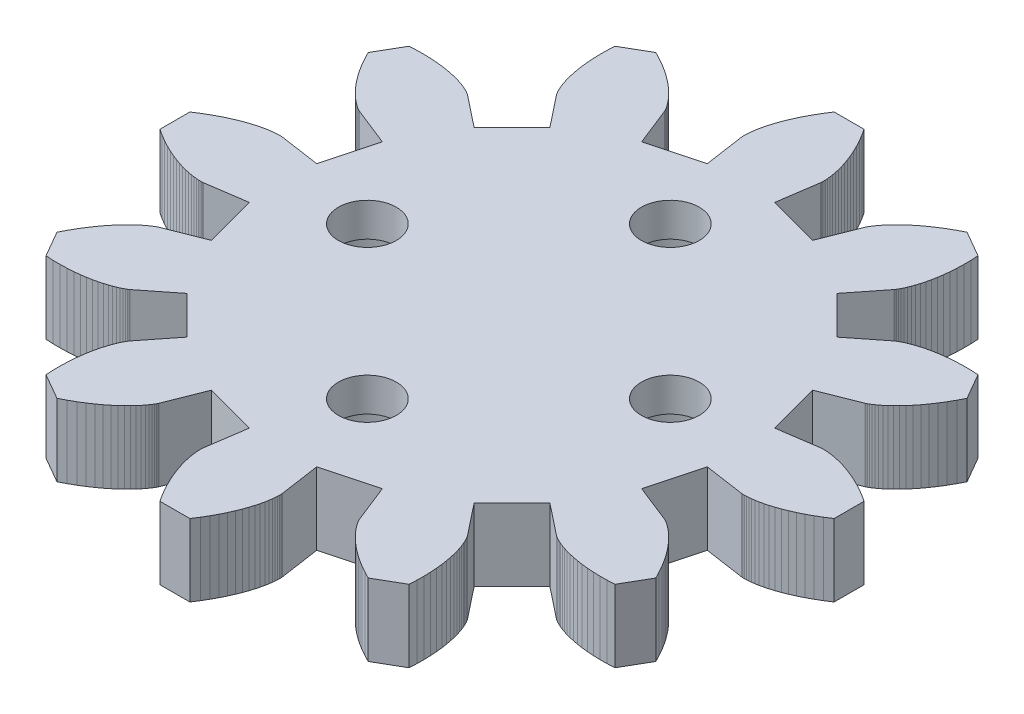
from build123d import *

# Parameters (mm, degrees)
BOSS_EXTRUDE1_DEPTH = 3
CIRPATTERN1_COUNT   = 4


with BuildPart() as part:
    # Sketch2 → Boss-Extrude1 (new body)
    with BuildSketch(Plane(origin=(0, 0, 0), x_dir=(1, 0, 0), z_dir=(0, 1, 0))):
        Polygon((9.498138322, 1.394764644), (11.156663116, 1.638312555), (11.165058045, 1.639324689), (11.190331947, 1.64149246), (11.232561637, 1.64350814), (11.291747908, 1.644060767), (11.367815439, 1.64184007), (11.460612882, 1.635540401), (11.569913152, 1.623864649), (11.695413894, 1.605528155), (11.836738145, 1.579262579), (11.993435184, 1.543819756), (12.164981564, 1.497975492), (12.350782331, 1.440533319), (12.550172424, 1.370328182), (12.762418247, 1.286230068), (12.986719425, 1.18714755), (13.222210727, 1.072031248), (13.467964155, 0.939877204), (13.722991197, 0.789730147), (13.986245242, 0.620686658), (13.986245242, -0.620686658), (13.722991197, -0.789730147), (13.467964155, -0.939877204), (13.222210727, -1.072031248), (12.986719425, -1.18714755), (12.762418247, -1.286230068), (12.550172424, -1.370328182), (12.350782331, -1.440533319), (12.164981564, -1.497975492), (11.993435184, -1.543819756), (11.836738145, -1.579262579), (11.695413894, -1.605528155), (11.569913152, -1.623864649), (11.460612882, -1.635540401), (11.367815439, -1.64184007), (11.291747908, -1.644060767), (11.232561637, -1.64350814), (11.190331947, -1.64149246), (11.165058045, -1.639324689), (11.156663116, -1.638312555), (9.498138322, -1.394764644), (8.923011398, -3.541167547), (10.481109957, -4.159511266), (10.488886246, -4.162832196), (10.511857973, -4.173591803), (10.549437797, -4.192961018), (10.600970925, -4.222075565), (10.665736991, -4.262032509), (10.742952099, -4.313886905), (10.831771034, -4.378648537), (10.931289617, -4.457278779), (11.040547221, -4.55068756), (11.158529426, -4.659730464), (11.284170817, -4.785205951), (11.416357915, -4.927852717), (11.553932232, -5.088347195), (11.695693449, -5.267301209), (11.840402709, -5.465259777), (11.986786008, -5.682699069), (12.133537698, -5.920024542), (12.279324066, -6.177569229), (12.422787013, -6.455592207), (11.802100354, -7.530653035), (11.489593919, -7.545421968), (11.193660493, -7.547939613), (10.91475476, -7.539511658), (10.653255159, -7.521459649), (10.409463382, -7.495117037), (10.18360405, -7.461825229), (9.975824596, -7.422929615), (9.786195324, -7.379775612), (9.61470967, -7.333704719), (9.461284642, -7.286050585), (9.325761463, -7.238135115), (9.207906385, -7.191264615), (9.107411699, -7.146725977), (9.02389692, -7.105782929), (8.956910158, -7.069672344), (8.905929657, -7.039600619), (8.870365513, -7.016740144), (8.849561557, -7.002225848), (8.842797402, -6.99715185), (7.528246754, -5.956970775), (5.956970775, -7.528246754), (6.99715185, -8.842797402), (7.002225848, -8.849561557), (7.016740144, -8.870365513), (7.039600619, -8.905929657), (7.069672344, -8.956910158), (7.105782929, -9.02389692), (7.146725977, -9.107411699), (7.191264615, -9.207906385), (7.238135115, -9.325761463), (7.286050585, -9.461284642), (7.333704719, -9.61470967), (7.379775612, -9.786195324), (7.422929615, -9.975824596), (7.461825229, -10.18360405), (7.495117037, -10.409463382), (7.521459649, -10.653255159), (7.539511658, -10.91475476), (7.547939613, -11.193660493), (7.545421968, -11.489593919), (7.530653035, -11.802100354), (6.455592207, -12.422787013), (6.177569229, -12.279324066), (5.920024542, -12.133537698), (5.682699069, -11.986786008), (5.465259777, -11.840402709), (5.267301209, -11.695693449), (5.088347195, -11.553932232), (4.927852717, -11.416357915), (4.785205951, -11.284170817), (4.659730464, -11.158529426), (4.55068756, -11.040547221), (4.457278779, -10.931289617), (4.378648537, -10.831771034), (4.313886905, -10.742952099), (4.262032509, -10.665736991), (4.222075565, -10.600970925), (4.192961018, -10.549437797), (4.173591803, -10.511857973), (4.162832196, -10.488886246), (4.159511266, -10.481109957), (3.541167547, -8.923011398), (1.394764644, -9.498138322), (1.638312555, -11.156663116), (1.639324689, -11.165058045), (1.64149246, -11.190331947), (1.64350814, -11.232561637), (1.644060767, -11.291747908), (1.64184007, -11.367815439), (1.635540401, -11.460612882), (1.623864649, -11.569913152), (1.605528155, -11.695413894), (1.579262579, -11.836738145), (1.543819756, -11.993435184), (1.497975492, -12.164981564), (1.440533319, -12.350782331), (1.370328182, -12.550172424), (1.286230068, -12.762418247), (1.18714755, -12.986719425), (1.072031248, -13.222210727), (0.939877204, -13.467964155), (0.789730147, -13.722991197), (0.620686658, -13.986245242), (-0.620686658, -13.986245242), (-0.789730147, -13.722991197), (-0.939877204, -13.467964155), (-1.072031248, -13.222210727), (-1.18714755, -12.986719425), (-1.286230068, -12.762418247), (-1.370328182, -12.550172424), (-1.440533319, -12.350782331), (-1.497975492, -12.164981564), (-1.543819756, -11.993435184), (-1.579262579, -11.836738145), (-1.605528155, -11.695413894), (-1.623864649, -11.569913152), (-1.635540401, -11.460612882), (-1.64184007, -11.367815439), (-1.644060767, -11.291747908), (-1.64350814, -11.232561637), (-1.64149246, -11.190331947), (-1.639324689, -11.165058045), (-1.638312555, -11.156663116), (-1.394764644, -9.498138322), (-3.541167547, -8.923011398), (-4.159511266, -10.481109957), (-4.162832196, -10.488886246), (-4.173591803, -10.511857973), (-4.192961018, -10.549437797), (-4.222075565, -10.600970925), (-4.262032509, -10.665736991), (-4.313886905, -10.742952099), (-4.378648537, -10.831771034), (-4.457278779, -10.931289617), (-4.55068756, -11.040547221), (-4.659730464, -11.158529426), (-4.785205951, -11.284170817), (-4.927852717, -11.416357915), (-5.088347195, -11.553932232), (-5.267301209, -11.695693449), (-5.465259777, -11.840402709), (-5.682699069, -11.986786008), (-5.920024542, -12.133537698), (-6.177569229, -12.279324066), (-6.455592207, -12.422787013), (-7.530653035, -11.802100354), (-7.545421968, -11.489593919), (-7.547939613, -11.193660493), (-7.539511658, -10.91475476), (-7.521459649, -10.653255159), (-7.495117037, -10.409463382), (-7.461825229, -10.18360405), (-7.422929615, -9.975824596), (-7.379775612, -9.786195324), (-7.333704719, -9.61470967), (-7.286050585, -9.461284642), (-7.238135115, -9.325761463), (-7.191264615, -9.207906385), (-7.146725977, -9.107411699), (-7.105782929, -9.02389692), (-7.069672344, -8.956910158), (-7.039600619, -8.905929657), (-7.016740144, -8.870365513), (-7.002225848, -8.849561557), (-6.99715185, -8.842797402), (-5.956970775, -7.528246754), (-7.528246754, -5.956970775), (-8.842797402, -6.99715185), (-8.849561557, -7.002225848), (-8.870365513, -7.016740144), (-8.905929657, -7.039600619), (-8.956910158, -7.069672344), (-9.02389692, -7.105782929), (-9.107411699, -7.146725977), (-9.207906385, -7.191264615), (-9.325761463, -7.238135115), (-9.461284642, -7.286050585), (-9.61470967, -7.333704719), (-9.786195324, -7.379775612), (-9.975824596, -7.422929615), (-10.18360405, -7.461825229), (-10.409463382, -7.495117037), (-10.653255159, -7.521459649), (-10.91475476, -7.539511658), (-11.193660493, -7.547939613), (-11.489593919, -7.545421968), (-11.802100354, -7.530653035), (-12.422787013, -6.455592207), (-12.279324066, -6.177569229), (-12.133537698, -5.920024542), (-11.986786008, -5.682699069), (-11.840402709, -5.465259777), (-11.695693449, -5.267301209), (-11.553932232, -5.088347195), (-11.416357915, -4.927852717), (-11.284170817, -4.785205951), (-11.158529426, -4.659730464), (-11.040547221, -4.55068756), (-10.931289617, -4.457278779), (-10.831771034, -4.378648537), (-10.742952099, -4.313886905), (-10.665736991, -4.262032509), (-10.600970925, -4.222075565), (-10.549437797, -4.192961018), (-10.511857973, -4.173591803), (-10.488886246, -4.162832196), (-10.481109957, -4.159511266), (-8.923011398, -3.541167547), (-9.498138322, -1.394764644), (-11.156663116, -1.638312555), (-11.165058045, -1.639324689), (-11.190331947, -1.64149246), (-11.232561637, -1.64350814), (-11.291747908, -1.644060767), (-11.367815439, -1.64184007), (-11.460612882, -1.635540401), (-11.569913152, -1.623864649), (-11.695413894, -1.605528155), (-11.836738145, -1.579262579), (-11.993435184, -1.543819756), (-12.164981564, -1.497975492), (-12.350782331, -1.440533319), (-12.550172424, -1.370328182), (-12.762418247, -1.286230068), (-12.986719425, -1.18714755), (-13.222210727, -1.072031248), (-13.467964155, -0.939877204), (-13.722991197, -0.789730147), (-13.986245242, -0.620686658), (-13.986245242, 0.620686658), (-13.722991197, 0.789730147), (-13.467964155, 0.939877204), (-13.222210727, 1.072031248), (-12.986719425, 1.18714755), (-12.762418247, 1.286230068), (-12.550172424, 1.370328182), (-12.350782331, 1.440533319), (-12.164981564, 1.497975492), (-11.993435184, 1.543819756), (-11.836738145, 1.579262579), (-11.695413894, 1.605528155), (-11.569913152, 1.623864649), (-11.460612882, 1.635540401), (-11.367815439, 1.64184007), (-11.291747908, 1.644060767), (-11.232561637, 1.64350814), (-11.190331947, 1.64149246), (-11.165058045, 1.639324689), (-11.156663116, 1.638312555), (-9.498138322, 1.394764644), (-8.923011398, 3.541167547), (-10.481109957, 4.159511266), (-10.488886246, 4.162832196), (-10.511857973, 4.173591803), (-10.549437797, 4.192961018), (-10.600970925, 4.222075565), (-10.665736991, 4.262032509), (-10.742952099, 4.313886905), (-10.831771034, 4.378648537), (-10.931289617, 4.457278779), (-11.040547221, 4.55068756), (-11.158529426, 4.659730464), (-11.284170817, 4.785205951), (-11.416357915, 4.927852717), (-11.553932232, 5.088347195), (-11.695693449, 5.267301209), (-11.840402709, 5.465259777), (-11.986786008, 5.682699069), (-12.133537698, 5.920024542), (-12.279324066, 6.177569229), (-12.422787013, 6.455592207), (-11.802100354, 7.530653035), (-11.489593919, 7.545421968), (-11.193660493, 7.547939613), (-10.91475476, 7.539511658), (-10.653255159, 7.521459649), (-10.409463382, 7.495117037), (-10.18360405, 7.461825229), (-9.975824596, 7.422929615), (-9.786195324, 7.379775612), (-9.61470967, 7.333704719), (-9.461284642, 7.286050585), (-9.325761463, 7.238135115), (-9.207906385, 7.191264615), (-9.107411699, 7.146725977), (-9.02389692, 7.105782929), (-8.956910158, 7.069672344), (-8.905929657, 7.039600619), (-8.870365513, 7.016740144), (-8.849561557, 7.002225848), (-8.842797402, 6.99715185), (-7.528246754, 5.956970775), (-5.956970775, 7.528246754), (-6.99715185, 8.842797402), (-7.002225848, 8.849561557), (-7.016740144, 8.870365513), (-7.039600619, 8.905929657), (-7.069672344, 8.956910158), (-7.105782929, 9.02389692), (-7.146725977, 9.107411699), (-7.191264615, 9.207906385), (-7.238135115, 9.325761463), (-7.286050585, 9.461284642), (-7.333704719, 9.61470967), (-7.379775612, 9.786195324), (-7.422929615, 9.975824596), (-7.461825229, 10.18360405), (-7.495117037, 10.409463382), (-7.521459649, 10.653255159), (-7.539511658, 10.91475476), (-7.547939613, 11.193660493), (-7.545421968, 11.489593919), (-7.530653035, 11.802100354), (-6.455592207, 12.422787013), (-6.177569229, 12.279324066), (-5.920024542, 12.133537698), (-5.682699069, 11.986786008), (-5.465259777, 11.840402709), (-5.267301209, 11.695693449), (-5.088347195, 11.553932232), (-4.927852717, 11.416357915), (-4.785205951, 11.284170817), (-4.659730464, 11.158529426), (-4.55068756, 11.040547221), (-4.457278779, 10.931289617), (-4.378648537, 10.831771034), (-4.313886905, 10.742952099), (-4.262032509, 10.665736991), (-4.222075565, 10.600970925), (-4.192961018, 10.549437797), (-4.173591803, 10.511857973), (-4.162832196, 10.488886246), (-4.159511266, 10.481109957), (-3.541167547, 8.923011398), (-1.394764644, 9.498138322), (-1.638312555, 11.156663116), (-1.639324689, 11.165058045), (-1.64149246, 11.190331947), (-1.64350814, 11.232561637), (-1.644060767, 11.291747908), (-1.64184007, 11.367815439), (-1.635540401, 11.460612882), (-1.623864649, 11.569913152), (-1.605528155, 11.695413894), (-1.579262579, 11.836738145), (-1.543819756, 11.993435184), (-1.497975492, 12.164981564), (-1.440533319, 12.350782331), (-1.370328182, 12.550172424), (-1.286230068, 12.762418247), (-1.18714755, 12.986719425), (-1.072031248, 13.222210727), (-0.939877204, 13.467964155), (-0.789730147, 13.722991197), (-0.620686658, 13.986245242), (0.620686658, 13.986245242), (0.789730147, 13.722991197), (0.939877204, 13.467964155), (1.072031248, 13.222210727), (1.18714755, 12.986719425), (1.286230068, 12.762418247), (1.370328182, 12.550172424), (1.440533319, 12.350782331), (1.497975492, 12.164981564), (1.543819756, 11.993435184), (1.579262579, 11.836738145), (1.605528155, 11.695413894), (1.623864649, 11.569913152), (1.635540401, 11.460612882), (1.64184007, 11.367815439), (1.644060767, 11.291747908), (1.64350814, 11.232561637), (1.64149246, 11.190331947), (1.639324689, 11.165058045), (1.638312555, 11.156663116), (1.394764644, 9.498138322), (3.541167547, 8.923011398), (4.159511266, 10.481109957), (4.162832196, 10.488886246), (4.173591803, 10.511857973), (4.192961018, 10.549437797), (4.222075565, 10.600970925), (4.262032509, 10.665736991), (4.313886905, 10.742952099), (4.378648537, 10.831771034), (4.457278779, 10.931289617), (4.55068756, 11.040547221), (4.659730464, 11.158529426), (4.785205951, 11.284170817), (4.927852717, 11.416357915), (5.088347195, 11.553932232), (5.267301209, 11.695693449), (5.465259777, 11.840402709), (5.682699069, 11.986786008), (5.920024542, 12.133537698), (6.177569229, 12.279324066), (6.455592207, 12.422787013), (7.530653035, 11.802100354), (7.545421968, 11.489593919), (7.547939613, 11.193660493), (7.539511658, 10.91475476), (7.521459649, 10.653255159), (7.495117037, 10.409463382), (7.461825229, 10.18360405), (7.422929615, 9.975824596), (7.379775612, 9.786195324), (7.333704719, 9.61470967), (7.286050585, 9.461284642), (7.238135115, 9.325761463), (7.191264615, 9.207906385), (7.146725977, 9.107411699), (7.105782929, 9.02389692), (7.069672344, 8.956910158), (7.039600619, 8.905929657), (7.016740144, 8.870365513), (7.002225848, 8.849561557), (6.99715185, 8.842797402), (5.956970775, 7.528246754), (7.528246754, 5.956970775), (8.842797402, 6.99715185), (8.849561557, 7.002225848), (8.870365513, 7.016740144), (8.905929657, 7.039600619), (8.956910158, 7.069672344), (9.02389692, 7.105782929), (9.107411699, 7.146725977), (9.207906385, 7.191264615), (9.325761463, 7.238135115), (9.461284642, 7.286050585), (9.61470967, 7.333704719), (9.786195324, 7.379775612), (9.975824596, 7.422929615), (10.18360405, 7.461825229), (10.409463382, 7.495117037), (10.653255159, 7.521459649), (10.91475476, 7.539511658), (11.193660493, 7.547939613), (11.489593919, 7.545421968), (11.802100354, 7.530653035), (12.422787013, 6.455592207), (12.279324066, 6.177569229), (12.133537698, 5.920024542), (11.986786008, 5.682699069), (11.840402709, 5.465259777), (11.695693449, 5.267301209), (11.553932232, 5.088347195), (11.416357915, 4.927852717), (11.284170817, 4.785205951), (11.158529426, 4.659730464), (11.040547221, 4.55068756), (10.931289617, 4.457278779), (10.831771034, 4.378648537), (10.742952099, 4.313886905), (10.665736991, 4.262032509), (10.600970925, 4.222075565), (10.549437797, 4.192961018), (10.511857973, 4.173591803), (10.488886246, 4.162832196), (10.481109957, 4.159511266), (8.923011398, 3.541167547), align=None)
    extrude(amount=BOSS_EXTRUDE1_DEPTH)

    # Sketch4 → CBORE for M2 Pan Head Screw1 (revolve, cut)
    with BuildSketch(Plane(origin=(0, 0, 6), x_dir=(0, 0, -1), z_dir=(1, 0, 0))):
        Polygon((0, 0), (0, 3.721032743), (1.2, 3), (1.2, 1.6), (2.5, 1.6), (2.5, 0), align=None)
    cbore_for_m2_pan_head_screw1 = revolve(axis=Axis((0, -6.35, 6), (0, 1, 0)), mode=Mode.SUBTRACT)

    # CirPattern1: CBORE for M2 Pan Head Screw1 ×4 about axis
    cirpattern1_axis = Axis((0, 0, -0.284392267), (0, 1, 0))
    for i in range(1, CIRPATTERN1_COUNT):
        add(cbore_for_m2_pan_head_screw1.rotate(cirpattern1_axis, i * 360 / CIRPATTERN1_COUNT), mode=Mode.SUBTRACT)


solid = part.part
